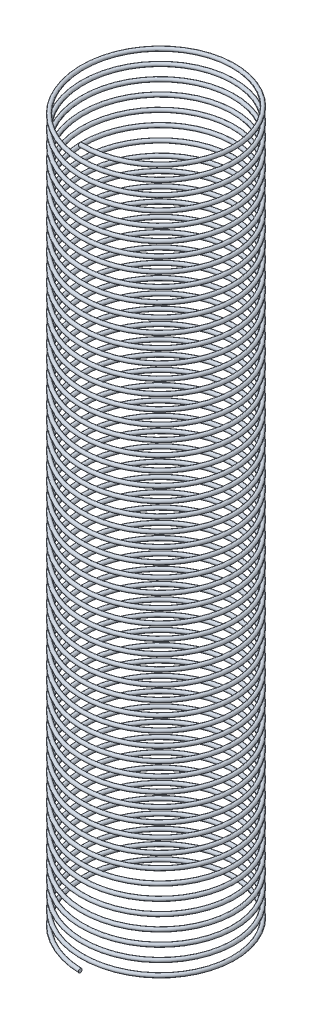
from build123d import *

# Parameters (mm, degrees)
SWEEP1_PITCH  = 0.35
SWEEP1_HEIGHT = 18.9
SWEEP1_RADIUS = 2
SKETCH2_R     = 0.05


with BuildPart() as part:
    # Sweep1: sweep along a helix
    with BuildLine() as sweep1_path:
        Helix(SWEEP1_PITCH, SWEEP1_HEIGHT, SWEEP1_RADIUS, center=(0, 0, 0), direction=(0, 1, 0), lefthand=True)
    # Sketch2 → Sweep1 (sweep)
    with BuildSketch(Plane(origin=(0, 0, 0), x_dir=(0, 0, -1), z_dir=(1, 0, 0))):
        with Locations((-2, 0)):
            Circle(SKETCH2_R)
    sweep(path=sweep1_path.line, is_frenet=True)


solid = part.part
